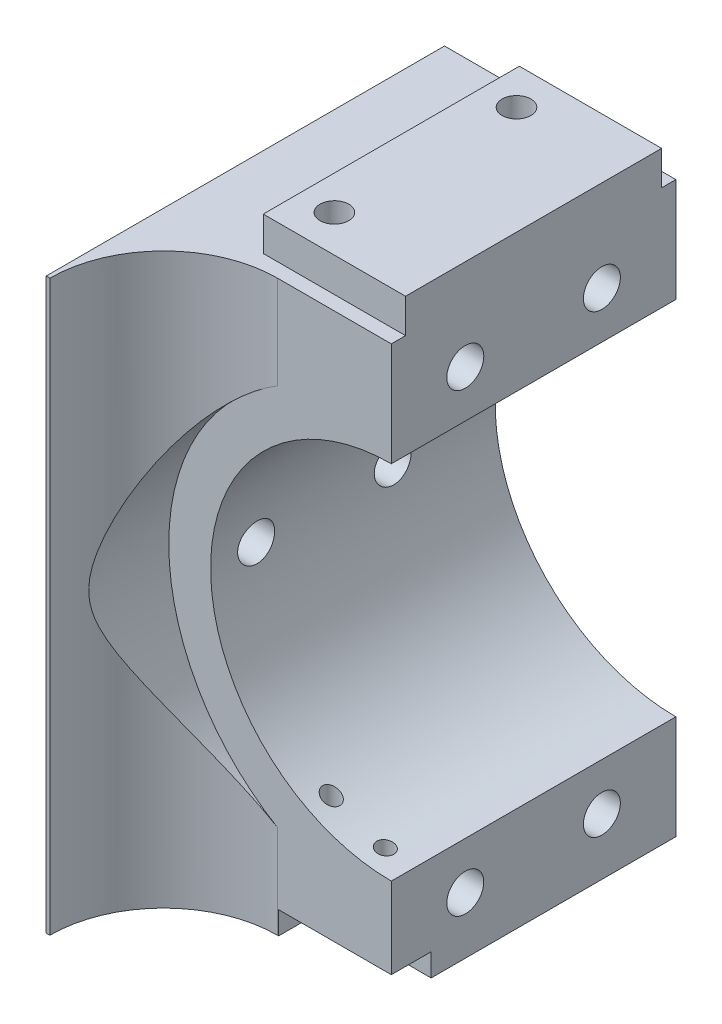
from build123d import *

# Parameters (mm, degrees)
CENTRE_HOLE_FOR_L2_DEPTH      = 40
CENTRE_HOLE_FOR_L2_DEPTH_BACK = 10
SKETCH1_R                     = 39.1
SKETCH1_R_2                   = 31.75
MAIN_STRUCTURE_DEPTH          = 60
MAIN_STRUCTURE_DEPTH_BACK     = 50
SKETCH2_W                     = 100
SKETCH2_H                     = 100
SKETCH2_R                     = 39.1
BEARING_CURVE_DEPTH           = 10
SKETCH6_R                     = 10.5
SHAFT_HOLE_DEPTH              = 10
WRIST_CUTOUT_DEPTH            = 188.082869339
SKETCH11_W                    = 25
SKETCH11_H                    = 45
SKETCH11_R                    = 2.525
BOSS_EXTRUDE1_DEPTH           = 6
SKETCH15_W                    = 19.8
SKETCH15_H                    = 7
CUT_EXTRUDE4_DEPTH            = 4
CUT_EXTRUDE5_REACH            = 190.16
CUT_EXTRUDE5_END_RADIUS       = 31.75
SKETCH16_R                    = 1.5
CUT_EXTRUDE6_DEPTH            = 168.7378908
CUT_EXTRUDE6_DEPTH_BACK       = 168.7378908
SKETCH18_R                    = 3.25
CUT_EXTRUDE7_START            = -1.5875
CUT_EXTRUDE7_DEPTH            = 1.5875
SKETCH9_R                     = 12.05
BEARING_DEPTH                 = 5
CUT_EXTRUDE8_DEPTH            = 3
SKETCH21_R                    = 3.25
SKETCH21_R_2                  = 1.65
CUT_EXTRUDE9_DEPTH            = 167.868211501
CUT_EXTRUDE10_DEPTH           = 6.35
SKETCH23_R                    = 2.275
CUT_EXTRUDE11_DEPTH           = 6
CHAMFER1_SIZE                 = 0.5


with BuildPart() as part:
    # Sketch1 → Centre Hole for L2 (new, two sides: drawn at the far end of the back side and taken through both)
    with BuildSketch(Plane.XY.offset(-CENTRE_HOLE_FOR_L2_DEPTH_BACK)):
        Circle(SKETCH1_R)
        Circle(SKETCH1_R_2, mode=Mode.SUBTRACT)
    extrude(amount=CENTRE_HOLE_FOR_L2_DEPTH + CENTRE_HOLE_FOR_L2_DEPTH_BACK)

    # Sketch2 → Main Structure (add, two sides: drawn at the far end of the back side and taken through both)
    with BuildSketch(Plane.XY.offset(40).offset(-MAIN_STRUCTURE_DEPTH_BACK)):
        Rectangle(SKETCH2_W, SKETCH2_H)
        Circle(SKETCH2_R, mode=Mode.SUBTRACT)
    extrude(amount=MAIN_STRUCTURE_DEPTH + MAIN_STRUCTURE_DEPTH_BACK)

    # Sketch3 → Bearing Curve (add)
    with BuildSketch(Plane.ZY.offset(50)):
        with BuildLine():
            Line((100, 50), (100, -50))
            ThreePointArc((100, -50), (150, 0), (100, 50))
        make_face()
    bearing_curve = extrude(amount=-BEARING_CURVE_DEPTH)

    # Upright Mirror: Bearing Curve across plane
    add(bearing_curve.mirror(Plane(origin=(0, 0, 0), x_dir=(0, 0, 1), z_dir=(1, 0, 0))))

    # Sketch6 → Shaft Hole (cut)
    with BuildSketch(Plane.ZY.offset(50)):
        with Locations((100, 0)):
            Circle(SKETCH6_R)
    extrude(amount=-SHAFT_HOLE_DEPTH, mode=Mode.SUBTRACT)

    # Sketch4 → Wrist Cutout (cut, through all)
    with BuildSketch(Plane(origin=(0, 50, 0), x_dir=(1, 0, 0), z_dir=(0, 1, 0))):
        with BuildLine():
            Line((-40, -100), (-40, -60))
            ThreePointArc((-40, -60), (-34.142135624, -45.857864376), (-20, -40))
            Line((-20, -40), (20, -40))
            ThreePointArc((20, -40), (34.142135624, -45.857864376), (40, -60))
            Line((40, -60), (40, -100))
            Line((40, -100), (-40, -100))
        make_face()
    extrude(amount=-WRIST_CUTOUT_DEPTH, mode=Mode.SUBTRACT)

    # SurfaceCut1
    split(bisect_by=Plane.ZY, keep=Keep.TOP)

    # Sketch11 → Boss-Extrude1 (add)
    with BuildSketch(Plane(origin=(0, 50, 0), x_dir=(1, 0, 0), z_dir=(0, 1, 0))):
        with Locations((-12.5, -15)):
            Rectangle(SKETCH11_W, SKETCH11_H)
        with Locations(Location((-19, 1, 0), (0, 0, 270))):
            Circle(SKETCH11_R, mode=Mode.SUBTRACT)
        with Locations(Location((-19, -31, 0), (0, 0, 270))):
            Circle(SKETCH11_R, mode=Mode.SUBTRACT)
    extrude(amount=BOSS_EXTRUDE1_DEPTH)

    # Sketch15 → Cut-Extrude4 (cut)
    with BuildSketch(Plane(origin=(0, -50, 0), x_dir=(-1, 0, 0), z_dir=(0, -1, 0))):
        with Locations((9.9, -36.5)):
            Rectangle(SKETCH15_W, SKETCH15_H)
    extrude(amount=-CUT_EXTRUDE4_DEPTH, mode=Mode.SUBTRACT)

    # Cut-Extrude5: up to this cylinder (the profile starts outside it)
    cut_extrude5_end = Plane(origin=(0, 0, 35.9), z_dir=(0, 0, 1)) * Cylinder(CUT_EXTRUDE5_END_RADIUS, 444.82, mode=Mode.PRIVATE)
    # Sketch16 → Cut-Extrude5 (cut, up to the surface)
    with BuildSketch(Plane(origin=(0, -46, 0), x_dir=(-1, 0, 0), z_dir=(0, -1, 0)), mode=Mode.PRIVATE) as cut_extrude5_sk1:
        with Locations(Location((14.65, -35.9, 0), (0, 0, 90))):
            Circle(SKETCH16_R)
    cut_extrude5_tool1 = extrude(cut_extrude5_sk1.sketch, amount=-CUT_EXTRUDE5_REACH, mode=Mode.PRIVATE) - cut_extrude5_end
    add(cut_extrude5_tool1.solids().sort_by_distance((-14.65, -46, 35.9))[0], mode=Mode.SUBTRACT)
    # Sketch16 → Cut-Extrude5 (cut, up to the surface)
    with BuildSketch(Plane(origin=(0, -46, 0), x_dir=(-1, 0, 0), z_dir=(0, -1, 0)), mode=Mode.PRIVATE) as cut_extrude5_sk2:
        with Locations(Location((5.15, -35.9, 0), (0, 0, 90))):
            Circle(SKETCH16_R)
    cut_extrude5_tool2 = extrude(cut_extrude5_sk2.sketch, amount=-CUT_EXTRUDE5_REACH, mode=Mode.PRIVATE) - cut_extrude5_end
    add(cut_extrude5_tool2.solids().sort_by_distance((-5.15, -46, 35.9))[0], mode=Mode.SUBTRACT)

    # Sketch18 → Cut-Extrude6 (cut, two sides: drawn at the far end of the back side and taken through both)
    with BuildSketch(Plane.ZY.offset(50).offset(-CUT_EXTRUDE6_DEPTH_BACK)):
        with Locations((8, 0)):
            Circle(SKETCH18_R)
        with Locations((32, 0)):
            Circle(SKETCH18_R)
    extrude(amount=CUT_EXTRUDE6_DEPTH + CUT_EXTRUDE6_DEPTH_BACK, mode=Mode.SUBTRACT)

    # Sketch19 → Cut-Extrude7 (cut)
    with BuildSketch(Plane(origin=(-40, 0, 0), x_dir=(0, 0, -1), z_dir=(1, 0, 0)).offset(CUT_EXTRUDE7_START)):
        with BuildLine():
            Line((-60, 50), (-100, 50))
            ThreePointArc((-100, 50), (-150, 0), (-100, -50))
            Line((-100, -50), (-60, -50))
            Line((-60, -50), (-60, 50))
        make_face()
    extrude(amount=CUT_EXTRUDE7_DEPTH, mode=Mode.SUBTRACT)

    # Sketch9 → Bearing (cut)
    with BuildSketch(Plane(origin=(-41.5875, 0, 0), x_dir=(0, 0, -1), z_dir=(1, 0, 0))):
        with Locations((-100, 0)):
            Circle(SKETCH9_R)
    extrude(amount=-BEARING_DEPTH, mode=Mode.SUBTRACT)

    # Sketch20 → Cut-Extrude8 (cut)
    with BuildSketch(Plane.ZY.offset(50)):
        with BuildLine():
            Line((-10, -50), (100, -50))
            ThreePointArc((100, -50), (150, 0), (100, 50))
            Line((100, 50), (-10, 50))
            Line((-10, 50), (-10, -50))
        make_face()
    extrude(amount=-CUT_EXTRUDE8_DEPTH, mode=Mode.SUBTRACT)

    # Sketch21 → Cut-Extrude9 (cut, through all)
    with BuildSketch(Plane.ZY.offset(47)):
        with Locations((3, -40)):
            Circle(SKETCH21_R)
        with Locations((27, -40)):
            Circle(SKETCH21_R)
        with Locations(Location((27, 40, 0), (0, 0, 180))):
            Circle(SKETCH21_R)
        with Locations(Location((3, 40, 0), (0, 0, 180))):
            Circle(SKETCH21_R)
        with Locations((125, 0)):
            Circle(SKETCH21_R_2)
    extrude(amount=-CUT_EXTRUDE9_DEPTH, mode=Mode.SUBTRACT)

    # Sketch22 → Cut-Extrude10 (cut)
    with BuildSketch(Plane.ZY.offset(47)):
        with BuildLine():
            Line((-10, 50), (-10, -50))
            Line((-10, -50), (100, -50))
            ThreePointArc((100, -50), (150, 0), (100, 50))
            Line((100, 50), (-10, 50))
        make_face()
    extrude(amount=-CUT_EXTRUDE10_DEPTH, mode=Mode.SUBTRACT)

    # Sketch23 → Cut-Extrude11 (cut)
    with BuildSketch(Plane(origin=(0, -50, 0), x_dir=(-1, 0, 0), z_dir=(0, -1, 0))):
        with Locations(Location((15, -7.25, 0), (0, 0, 90))):
            Circle(SKETCH23_R)
    extrude(amount=-CUT_EXTRUDE11_DEPTH, mode=Mode.SUBTRACT)

    # Chamfer1
    chamfer1_edges = [part.edges().sort_by_distance(p)[0] for p in [
        (-15, -50, 9.525),
    ]]
    chamfer(chamfer1_edges, length=CHAMFER1_SIZE)


solid = part.part
